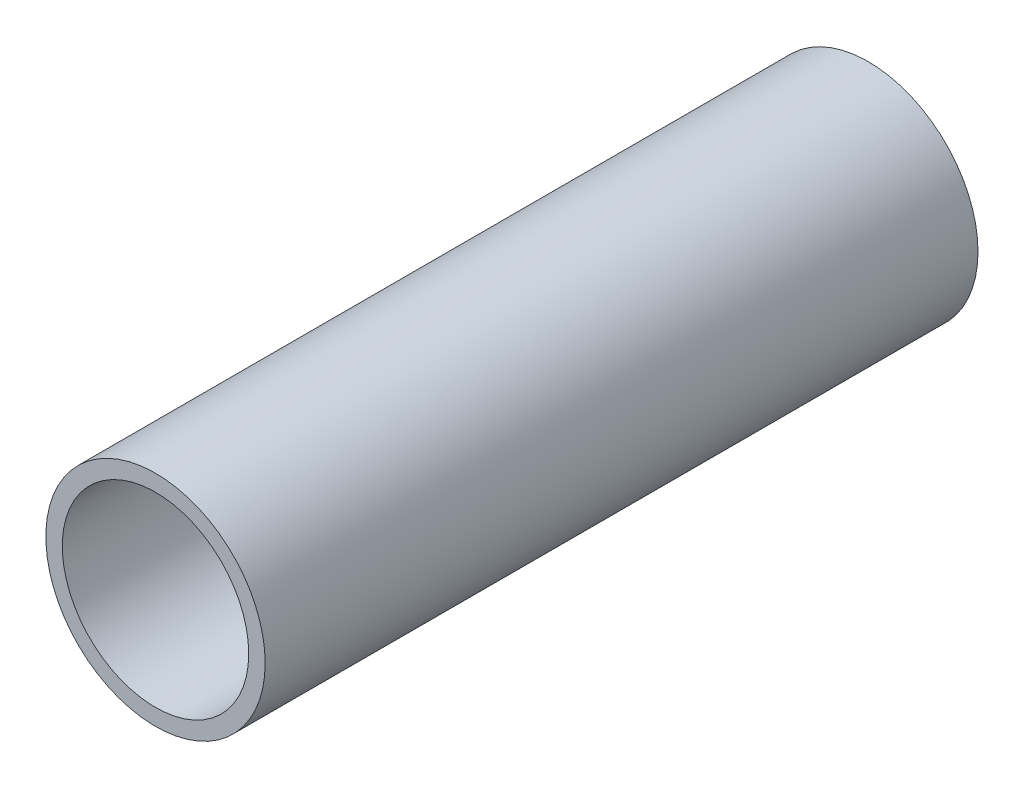
from build123d import *

# Parameters (mm, degrees)
SKETCH1_R           = 10
SKETCH1_R_2         = 8.5
BOSS_EXTRUDE1_DEPTH = 65


with BuildPart() as part:
    # Sketch1 → Boss-Extrude1 (new body)
    with BuildSketch(Plane.XY):
        Circle(SKETCH1_R)
        Circle(SKETCH1_R_2, mode=Mode.SUBTRACT)
    extrude(amount=BOSS_EXTRUDE1_DEPTH)


solid = part.part
